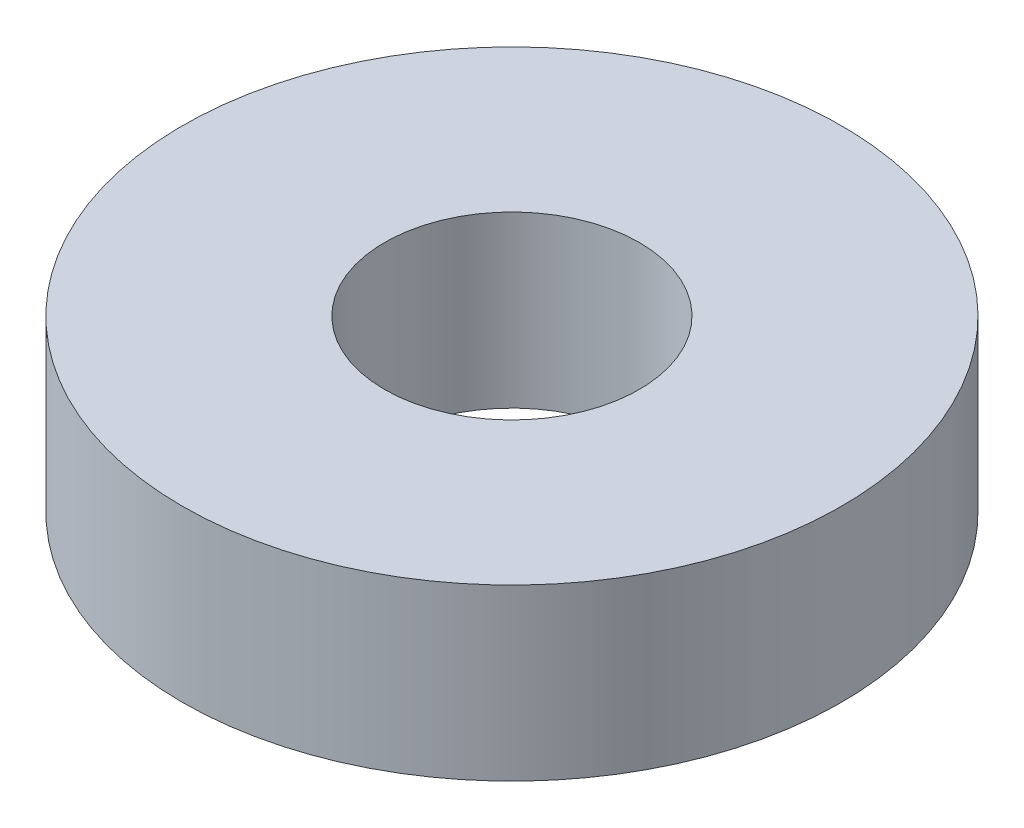
from build123d import *

# Parameters (mm, degrees)
SKETCH1_R           = 8.15
SKETCH1_R_2         = 3.15
BOSS_EXTRUDE1_DEPTH = 4.2


with BuildPart() as part:
    # Sketch1 → Boss-Extrude1 (new body)
    with BuildSketch(Plane(origin=(0, 0, 0), x_dir=(1, 0, 0), z_dir=(0, 1, 0))):
        with Locations(Location((0, 0, 0), (0, 0, 270))):
            Circle(SKETCH1_R)
        with Locations(Location((0, 0, 0), (0, 0, 270))):
            Circle(SKETCH1_R_2, mode=Mode.SUBTRACT)
    extrude(amount=BOSS_EXTRUDE1_DEPTH)


solid = part.part
